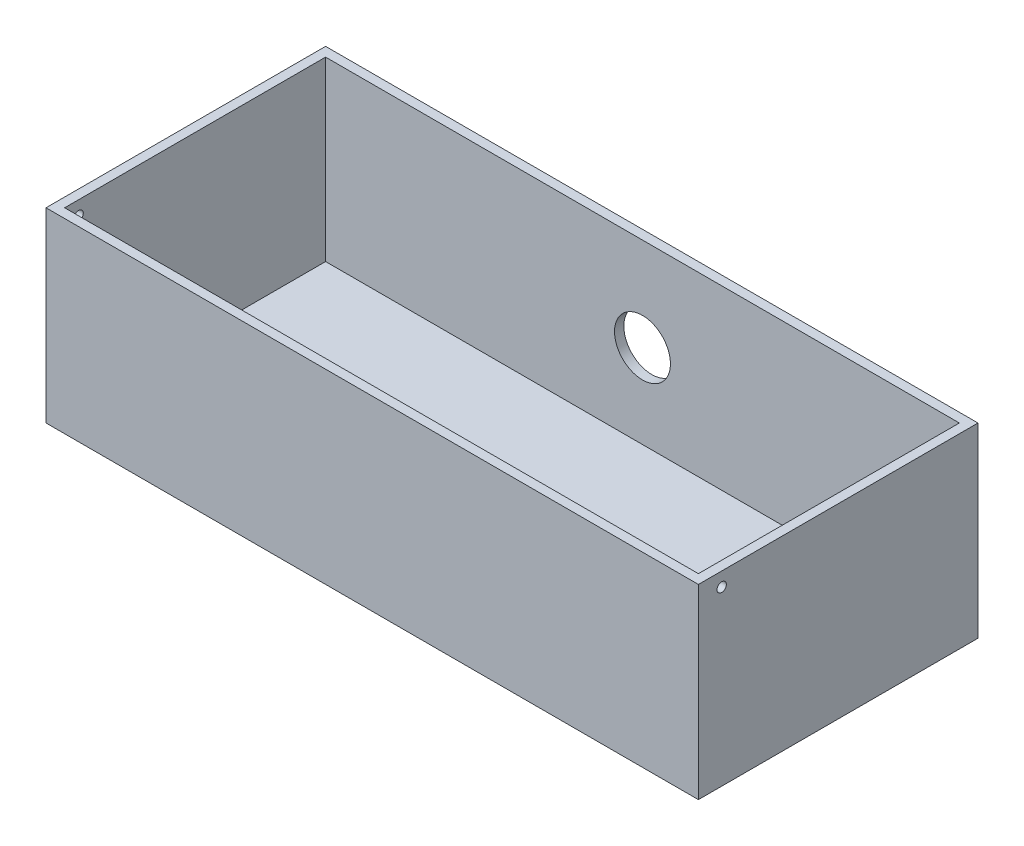
from build123d import *

# Parameters (mm, degrees)
CROQUIS1_W              = 700
CROQUIS1_H              = 300
SALIENTE_EXTRUIR1_DEPTH = 200
CROQUIS2_W              = 680
CROQUIS2_H              = 280
CORTAR_EXTRUIR1_DEPTH   = 190
CROQUIS3_R              = 5
CORTAR_EXTRUIR2_DEPTH   = 700
CROQUIS4_R              = 30
CORTAR_EXTRUIR3_DEPTH   = 10


with BuildPart() as part:
    # Croquis1 → Saliente-Extruir1 (new body)
    with BuildSketch(Plane(origin=(0, 0, 0), x_dir=(1, 0, 0), z_dir=(0, 1, 0))):
        Rectangle(CROQUIS1_W, CROQUIS1_H)
    extrude(amount=SALIENTE_EXTRUIR1_DEPTH)

    # Croquis2 → Cortar-Extruir1 (cut)
    with BuildSketch(Plane(origin=(0, 200, 0), x_dir=(1, 0, 0), z_dir=(0, 1, 0))):
        Rectangle(CROQUIS2_W, CROQUIS2_H)
    extrude(amount=-CORTAR_EXTRUIR1_DEPTH, mode=Mode.SUBTRACT)

    # Croquis3 → Cortar-Extruir2 (cut)
    with BuildSketch(Plane(origin=(350, 0, 0), x_dir=(0, 0, -1), z_dir=(1, 0, 0))):
        with Locations((-125, 185)):
            Circle(CROQUIS3_R)
    extrude(amount=-CORTAR_EXTRUIR2_DEPTH, mode=Mode.SUBTRACT)

    # Croquis4 → Cortar-Extruir3 (cut)
    with BuildSketch(Plane(origin=(0, 0, -150), x_dir=(-1, 0, 0), z_dir=(0, 0, -1))):
        with Locations((0, 100)):
            Circle(CROQUIS4_R)
    extrude(amount=-CORTAR_EXTRUIR3_DEPTH, mode=Mode.SUBTRACT)


solid = part.part
